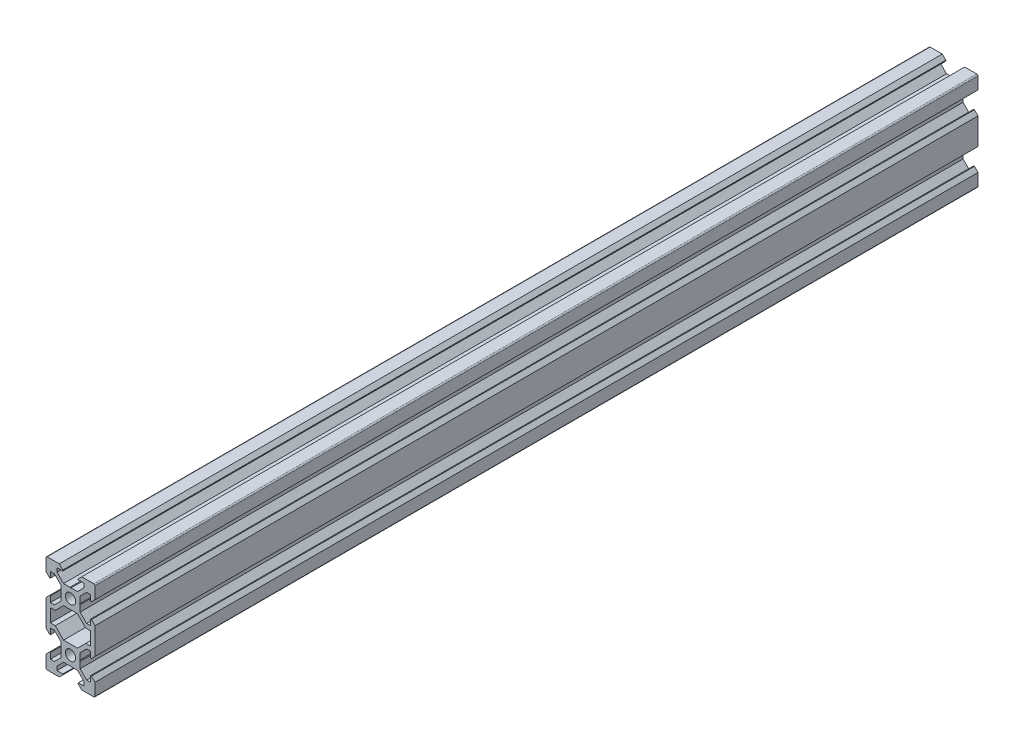
from build123d import *

# Parameters (mm, degrees)
SKETCH1_R           = 2.1
BOSS_EXTRUDE1_DEPTH = 180.2


with BuildPart() as part:
    # Sketch1 → Boss-Extrude1 (new, symmetric)
    with BuildSketch(Plane.XY):
        with BuildLine():
            Line((4.58, -20), (9.5, -20))
            ThreePointArc((9.5, -20), (9.853553391, -19.853553391), (10, -19.5))
            Line((10, -19.5), (10, -14.58))
            Line((10, -14.58), (8.545, -13.125))
            Line((8.545, -13.125), (8.2, -13.125))
            Line((8.2, -13.125), (8.2, -15.5))
            Line((8.2, -15.5), (6.560660172, -15.5))
            Line((6.560660172, -15.5), (3.9, -12.839339828))
            Line((3.9, -12.839339828), (3.9, -10.21))
            Line((3.9, -10.21), (3.69, -10))
            Line((3.69, -10), (3.9, -9.79))
            Line((3.9, -9.79), (3.9, -7.160660172))
            Line((3.9, -7.160660172), (6.560660172, -4.5))
            Line((6.560660172, -4.5), (8.2, -4.5))
            Line((8.2, -4.5), (8.2, -6.875))
            Line((8.2, -6.875), (8.545, -6.875))
            Line((8.545, -6.875), (10, -5.42))
            Line((10, -5.42), (10, 5.42))
            Line((10, 5.42), (8.545, 6.875))
            Line((8.545, 6.875), (8.2, 6.875))
            Line((8.2, 6.875), (8.2, 4.5))
            Line((8.2, 4.5), (6.560660172, 4.5))
            Line((6.560660172, 4.5), (3.9, 7.160660172))
            Line((3.9, 7.160660172), (3.9, 9.79))
            Line((3.9, 9.79), (3.69, 10))
            Line((3.69, 10), (3.9, 10.21))
            Line((3.9, 10.21), (3.9, 12.839339828))
            Line((3.9, 12.839339828), (6.560660172, 15.5))
            Line((6.560660172, 15.5), (8.2, 15.5))
            Line((8.2, 15.5), (8.2, 13.125))
            Line((8.2, 13.125), (8.545, 13.125))
            Line((8.545, 13.125), (10, 14.58))
            Line((10, 14.58), (10, 19.5))
            ThreePointArc((10, 19.5), (9.853553391, 19.853553391), (9.5, 20))
            Line((9.5, 20), (4.58, 20))
            Line((4.58, 20), (3.125, 18.545))
            Line((3.125, 18.545), (3.125, 18.2))
            Line((3.125, 18.2), (5.5, 18.2))
            Line((5.5, 18.2), (5.5, 16.560660172))
            Line((5.5, 16.560660172), (2.839339828, 13.9))
            Line((2.839339828, 13.9), (0.21, 13.9))
            Line((0.21, 13.9), (0, 13.69))
            Line((0, 13.69), (-0.21, 13.9))
            Line((-0.21, 13.9), (-2.839339828, 13.9))
            Line((-2.839339828, 13.9), (-5.5, 16.560660172))
            Line((-5.5, 16.560660172), (-5.5, 18.2))
            Line((-5.5, 18.2), (-3.125, 18.2))
            Line((-3.125, 18.2), (-3.125, 18.545))
            Line((-3.125, 18.545), (-4.58, 20))
            Line((-4.58, 20), (-9.5, 20))
            ThreePointArc((-9.5, 20), (-9.853553391, 19.853553391), (-10, 19.5))
            Line((-10, 19.5), (-10, 14.58))
            Line((-10, 14.58), (-8.545, 13.125))
            Line((-8.545, 13.125), (-8.2, 13.125))
            Line((-8.2, 13.125), (-8.2, 15.5))
            Line((-8.2, 15.5), (-6.560660172, 15.5))
            Line((-6.560660172, 15.5), (-3.9, 12.839339828))
            Line((-3.9, 12.839339828), (-3.9, 10.21))
            Line((-3.9, 10.21), (-3.69, 10))
            Line((-3.69, 10), (-3.9, 9.79))
            Line((-3.9, 9.79), (-3.9, 7.160660172))
            Line((-3.9, 7.160660172), (-6.560660172, 4.5))
            Line((-6.560660172, 4.5), (-8.2, 4.5))
            Line((-8.2, 4.5), (-8.2, 6.875))
            Line((-8.2, 6.875), (-8.545, 6.875))
            Line((-8.545, 6.875), (-10, 5.42))
            Line((-10, 5.42), (-10, -5.42))
            Line((-10, -5.42), (-8.545, -6.875))
            Line((-8.545, -6.875), (-8.2, -6.875))
            Line((-8.2, -6.875), (-8.2, -4.5))
            Line((-8.2, -4.5), (-6.560660172, -4.5))
            Line((-6.560660172, -4.5), (-3.9, -7.160660172))
            Line((-3.9, -7.160660172), (-3.9, -9.79))
            Line((-3.9, -9.79), (-3.69, -10))
            Line((-3.69, -10), (-3.9, -10.21))
            Line((-3.9, -10.21), (-3.9, -12.839339828))
            Line((-3.9, -12.839339828), (-6.560660172, -15.5))
            Line((-6.560660172, -15.5), (-8.2, -15.5))
            Line((-8.2, -15.5), (-8.2, -13.125))
            Line((-8.2, -13.125), (-8.545, -13.125))
            Line((-8.545, -13.125), (-10, -14.58))
            Line((-10, -14.58), (-10, -19.5))
            ThreePointArc((-10, -19.5), (-9.853553391, -19.853553391), (-9.5, -20))
            Line((-9.5, -20), (-4.58, -20))
            Line((-4.58, -20), (-3.125, -18.545))
            Line((-3.125, -18.545), (-3.125, -18.2))
            Line((-3.125, -18.2), (-5.5, -18.2))
            Line((-5.5, -18.2), (-5.5, -16.560660172))
            Line((-5.5, -16.560660172), (-2.839339828, -13.9))
            Line((-2.839339828, -13.9), (-0.21, -13.9))
            Line((-0.21, -13.9), (0, -13.69))
            Line((0, -13.69), (0.21, -13.9))
            Line((0.21, -13.9), (2.839339828, -13.9))
            Line((2.839339828, -13.9), (5.5, -16.560660172))
            Line((5.5, -16.560660172), (5.5, -18.2))
            Line((5.5, -18.2), (3.125, -18.2))
            Line((3.125, -18.2), (3.125, -18.545))
            Line((3.125, -18.545), (4.58, -20))
        make_face()
        with Locations((0, -10)):
            Circle(SKETCH1_R, mode=Mode.SUBTRACT)
        Polygon((-6.239339828, -2.7), (-8.2, -2.7), (-8.2, 2.7), (-6.239339828, 2.7), (-2.839339828, 6.1), (2.839339828, 6.1), (6.239339828, 2.7), (8.2, 2.7), (8.2, -2.7), (6.239339828, -2.7), (2.839339828, -6.1), (-2.839339828, -6.1), align=None, mode=Mode.SUBTRACT)
        with Locations((0, 10)):
            Circle(SKETCH1_R, mode=Mode.SUBTRACT)
    extrude(amount=BOSS_EXTRUDE1_DEPTH, both=True)


solid = part.part
